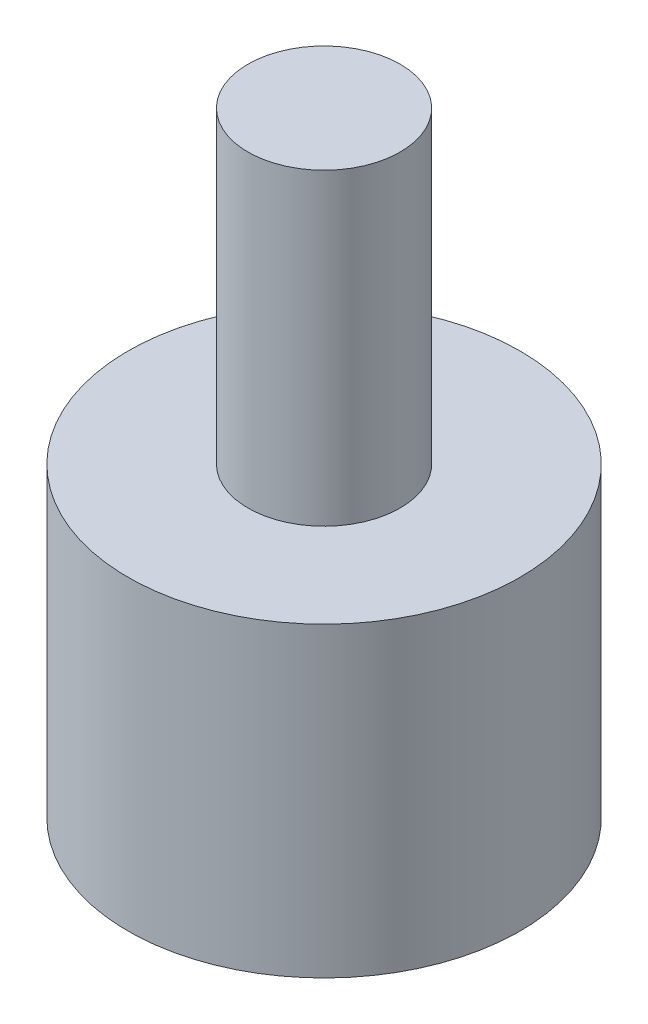
from build123d import *


with BuildPart() as part:
    # Esquisse1 → Révolution1 (revolve)
    with BuildSketch(Plane.XY, mode=Mode.PRIVATE) as r_volution1_sk:
        with BuildLine():
            Line((5.674504384, 3.5), (10.3, 3.5))
            Line((10.3, 3.5), (10.3, 19.6))
            Line((10.3, 19.6), (4, 19.6))
            Line((4, 19.6), (4, 35.8))
            Line((4, 35.8), (0, 35.8))
            Line((0, 35.8), (0, 0))
            ThreePointArc((0, 0), (3.33354166, 0.945372353), (5.674504384, 3.5))
        make_face()
    revolve(r_volution1_sk.sketch.rotate(Axis((0, -22.939375, 0), (0, 1, 0)), 90), axis=Axis((0, -22.939375, 0), (0, 1, 0)))


solid = part.part
